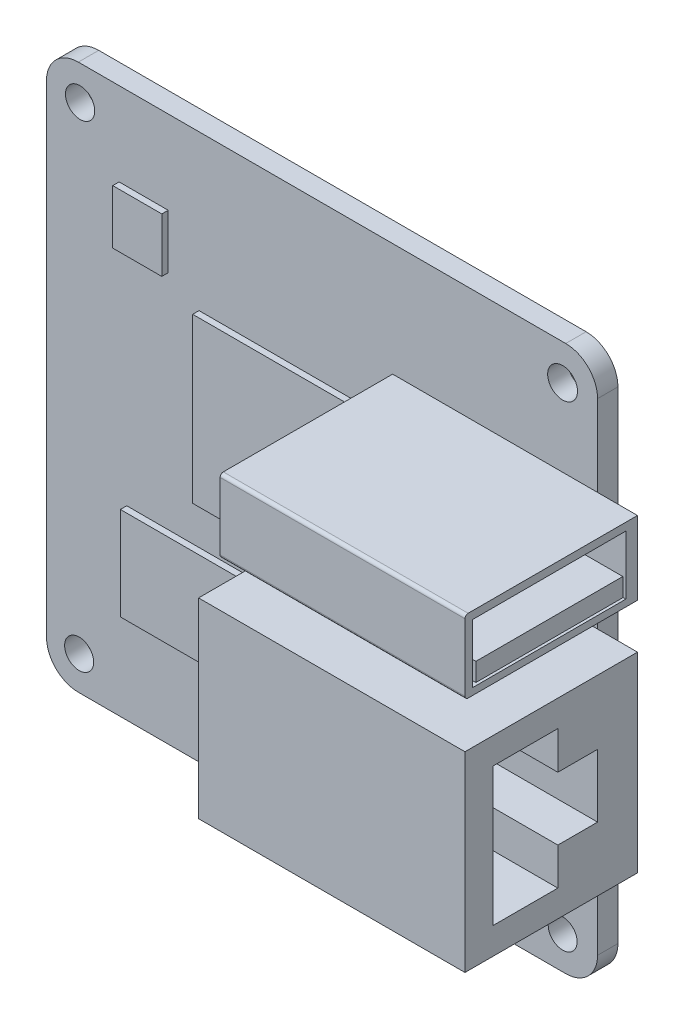
from build123d import *

# Parameters (mm, degrees)
BOSS_EXTRU_1_DEPTH      = 1.6
ESQUISSE3_R             = 1.148870596
ESQUISSE3_R_2           = 1.140783705
ESQUISSE3_R_3           = 1.172524647
ESQUISSE3_R_4           = 1.134797555
ENL_V_MAT_EXTRU_1_DEPTH = 1.6
COMPOSANTS_W            = 12.858194584
COMPOSANTS_H            = 12.858194584
COMPOSANTS_W_2          = 12.824969275
COMPOSANTS_H_2          = 7.30956798
COMPOSANTS_W_3          = 3.854135844
COMPOSANTS_H_3          = 4.252839552
BOSS_EXTRU_2_DEPTH      = 0.5
USB_W                   = 19.229644045
USB_H                   = 5.768893213
USB_W_2                 = 20.923684115
USB_H_2                 = 15.017436302
BOSS_EXTRU_3_DEPTH      = 13.55
ESQUISSE6_W             = 5.080672097
ESQUISSE6_H             = 10.850248885
ENL_V_MAT_EXTRU_2_DEPTH = 13.55
ESQUISSE7_W             = 3.121599382
ESQUISSE7_H             = 4.951502468
ENL_V_MAT_EXTRU_3_DEPTH = 13.55
ESQUISSE8_W             = 12.034303823
ESQUISSE8_H             = 4.628578393
ENL_V_MAT_EXTRU_4_DEPTH = 13.55
ESQUISSE9_W             = 11.539153577
ESQUISSE9_H             = 1.442394197
BOSS_EXTRU_4_DEPTH      = 13.55
CONG_1_R                = 0.25


with BuildPart() as part:
    # plaque → Boss.-Extru.1 (new body)
    with BuildSketch(Plane.XY):
        with BuildLine():
            Line((43.900262464, 135.755357431), (5.620539516, 135.755357431))
            ThreePointArc((5.620539516, 135.755357431), (3.852772563, 135.023124384), (3.120539516, 133.255357431))
            Line((3.120539516, 133.255357431), (3.120539516, 95.39098691))
            ThreePointArc((3.120539516, 95.39098691), (3.852772563, 93.623219957), (5.620539516, 92.89098691))
            Line((5.620539516, 92.89098691), (43.900262464, 92.89098691))
            ThreePointArc((43.900262464, 92.89098691), (45.668029417, 93.623219957), (46.400262464, 95.39098691))
            Line((46.400262464, 95.39098691), (46.400262464, 133.255357431))
            ThreePointArc((46.400262464, 133.255357431), (45.668029417, 135.023124384), (43.900262464, 135.755357431))
        make_face()
    extrude(amount=-BOSS_EXTRU_1_DEPTH)

    # Esquisse3 → Enlèv. mat.-Extru.1 (cut)
    with BuildSketch(Plane.XY):
        with Locations((5.759516269, 133.070860948)):
            Circle(ESQUISSE3_R)
        with Locations((5.683227949, 95.539332189)):
            Circle(ESQUISSE3_R_2)
        with Locations((43.653009493, 132.961233721)):
            Circle(ESQUISSE3_R_3)
        with Locations((43.659821284, 95.506212136)):
            Circle(ESQUISSE3_R_4)
    extrude(amount=-ENL_V_MAT_EXTRU_1_DEPTH, mode=Mode.SUBTRACT)

    # composants → Boss.-Extru.2 (add)
    with BuildSketch(Plane.XY):
        with Locations((21.530912713, 117.16211726)):
            Rectangle(COMPOSANTS_W, COMPOSANTS_H)
        with Locations((15.832772219, 103.822155695)):
            Rectangle(COMPOSANTS_W_2, COMPOSANTS_H_2)
        with Locations((10.749299941, 127.079871998)):
            Rectangle(COMPOSANTS_W_3, COMPOSANTS_H_3)
    extrude(amount=BOSS_EXTRU_2_DEPTH)

    # usb → Boss.-Extru.3 (add)
    with BuildSketch(Plane.XY):
        with Locations((39.921367739, 123.990139203)):
            Rectangle(USB_W, USB_H)
        with Locations((39.074347704, 110.071539704)):
            Rectangle(USB_W_2, USB_H_2)
    extrude(amount=BOSS_EXTRU_3_DEPTH)

    # Esquisse6 → Enlèv. mat.-Extru.2 (cut)
    with BuildSketch(Plane(origin=(49.536189761, 0, 0), x_dir=(0, 0, -1), z_dir=(1, 0, 0))):
        with Locations((-8.79520358, 110.082102666)):
            Rectangle(ESQUISSE6_W, ESQUISSE6_H)
    extrude(amount=-ENL_V_MAT_EXTRU_2_DEPTH, mode=Mode.SUBTRACT)

    # Esquisse7 → Enlèv. mat.-Extru.3 (cut)
    with BuildSketch(Plane(origin=(49.536189761, 0, 0), x_dir=(0, 0, -1), z_dir=(1, 0, 0))):
        with Locations((-4.69406784, 110.060574394)):
            Rectangle(ESQUISSE7_W, ESQUISSE7_H)
    extrude(amount=-ENL_V_MAT_EXTRU_3_DEPTH, mode=Mode.SUBTRACT)

    # Esquisse8 → Enlèv. mat.-Extru.4 (cut)
    with BuildSketch(Plane(origin=(49.536189761, 0, 0), x_dir=(0, 0, -1), z_dir=(1, 0, 0))):
        with Locations((-6.933008087, 123.957073711)):
            Rectangle(ESQUISSE8_W, ESQUISSE8_H)
    extrude(amount=-ENL_V_MAT_EXTRU_4_DEPTH, mode=Mode.SUBTRACT)

    # Esquisse9 → Boss.-Extru.4 (add)
    with BuildSketch(Plane(origin=(35.986189761, 0, 0), x_dir=(0, 0, -1), z_dir=(1, 0, 0))):
        with Locations((-6.922243951, 122.579264329)):
            Rectangle(ESQUISSE9_W, ESQUISSE9_H)
    extrude(amount=BOSS_EXTRU_4_DEPTH)

    # Congé1
    cong_1_edges = [part.edges().sort_by_distance(p)[0] for p in [
        (39.921367738, 121.105692596, 13.55),
        (39.921367738, 126.874585809, 13.55),
    ]]
    fillet(cong_1_edges, radius=CONG_1_R)


solid = part.part
